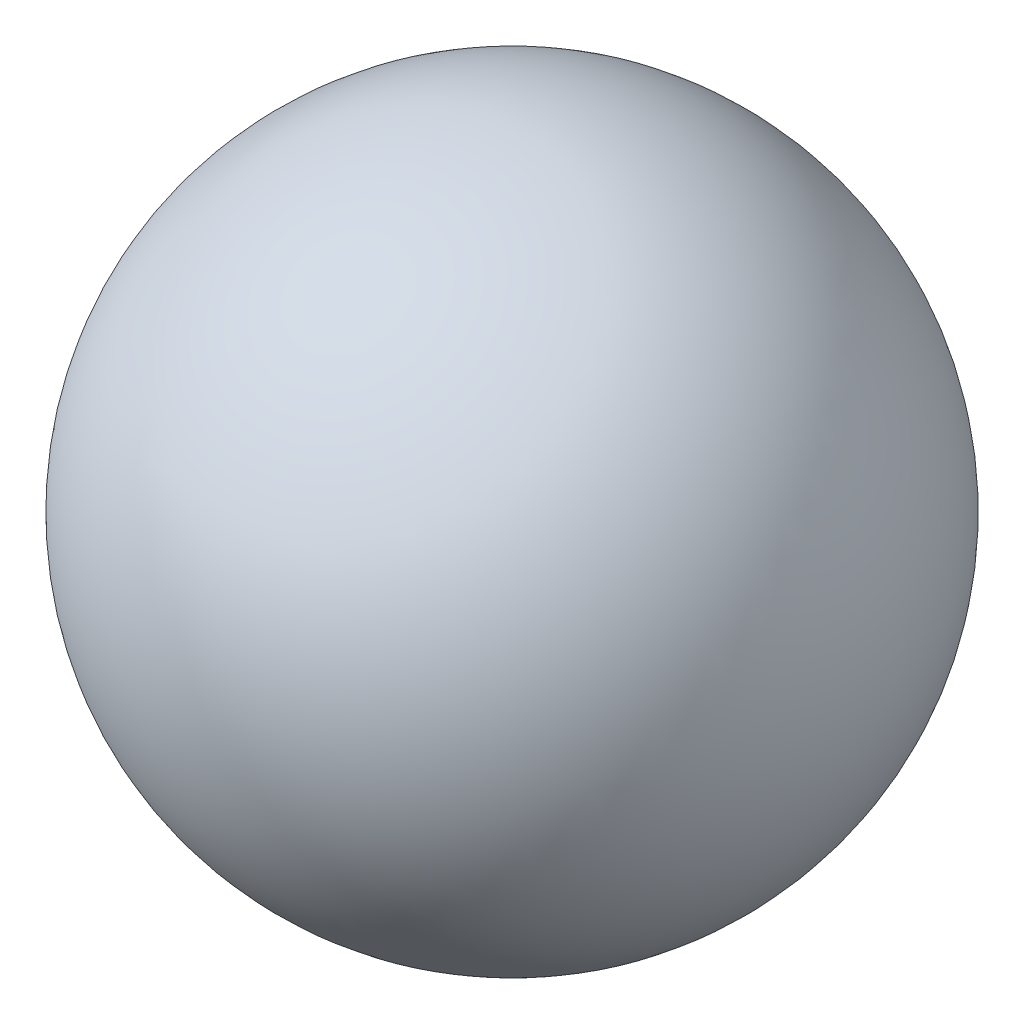
from build123d import *
from build123d.topology import SkipClean


with BuildPart() as part:
    # Sketch1 → Revolve1 (revolve)
    with SkipClean():  # the faces are left unmerged after this step: merging them gives an invalid solid
        with BuildSketch(Plane.XY):
            with BuildLine():
                ThreePointArc((7.14, 0), (5.048742418, 5.048742418), (0, 7.14))
                Line((0, 7.14), (0, -7.14))
                ThreePointArc((0, -7.14), (5.048742418, -5.048742418), (7.14, 0))
            make_face()
            with BuildLine():
                Line((0, -7.14), (0, 7.14))
                ThreePointArc((0, 7.14), (-7.14, 0), (0, -7.14))
            make_face()
        revolve(axis=Axis((0, 10.961815087, 0), (0, -1, 0)))


solid = part.part
